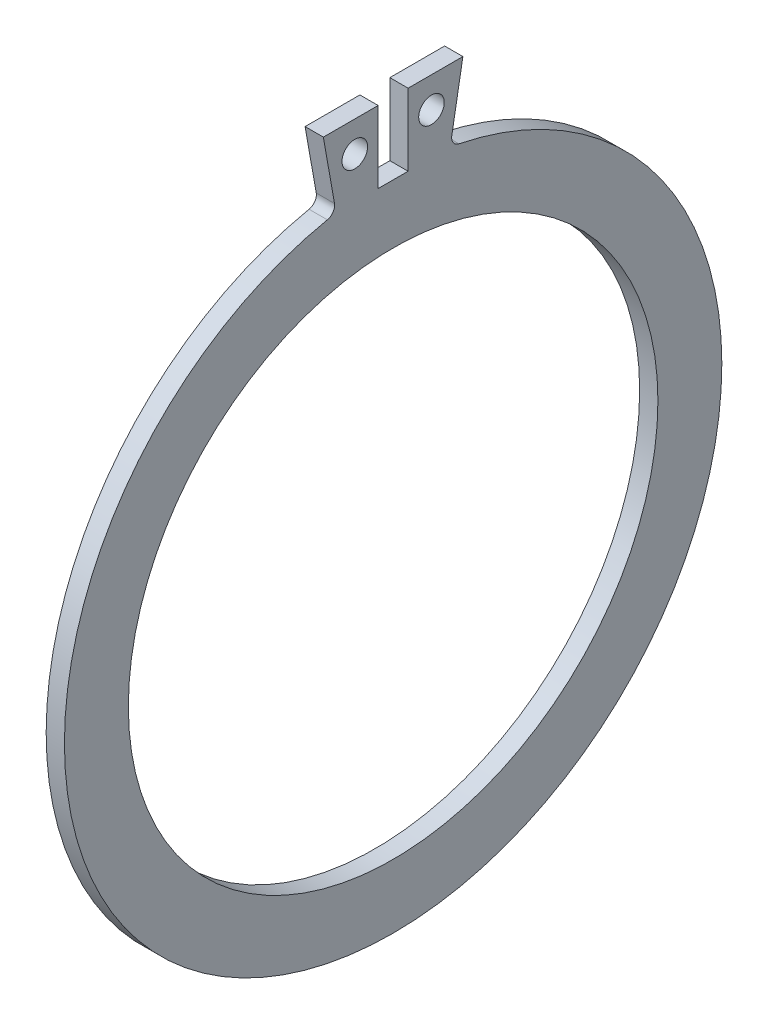
from build123d import *

# Parameters (mm, degrees)
SKETCH_1_R      = 14.5
SKETCH_1_R_2    = 0.7
EXTRUDE_1_DEPTH = 1


with BuildPart() as part:
    # 草图1 → 凸台-拉伸1 (new body)
    with BuildSketch(Plane(origin=(0, 0, 0), x_dir=(0, 0, -1), z_dir=(1, 0, 0))):
        with BuildLine():
            Line((-3.211317774, 18.212288109), (-3.820259909, 21.665770566))
            Line((-3.820259909, 21.665770566), (-0.820259909, 21.665770566))
            Line((-0.820259909, 21.665770566), (-0.820259909, 17.726539554))
            Line((-0.820259909, 17.726539554), (0.820259909, 17.726539554))
            Line((0.820259909, 17.726539554), (0.820259909, 21.665770566))
            Line((0.820259909, 21.665770566), (3.820259909, 21.665770566))
            Line((3.820259909, 21.665770566), (3.211317774, 18.212288109))
            ThreePointArc((3.211317774, 18.212288109), (3.290307164, 17.84423731), (3.603621065, 17.635586614))
            ThreePointArc((3.603621065, 17.635586614), (0, -18), (-3.603621065, 17.635586614))
            ThreePointArc((-3.603621065, 17.635586614), (-3.290307164, 17.84423731), (-3.211317774, 18.212288109))
        make_face()
        Circle(SKETCH_1_R, mode=Mode.SUBTRACT)
        with Locations((-2.1, 20)):
            Circle(SKETCH_1_R_2, mode=Mode.SUBTRACT)
        with Locations(Location((2.1, 20, 0), (0, 0, 180))):
            Circle(SKETCH_1_R_2, mode=Mode.SUBTRACT)
    extrude(amount=EXTRUDE_1_DEPTH)


solid = part.part
